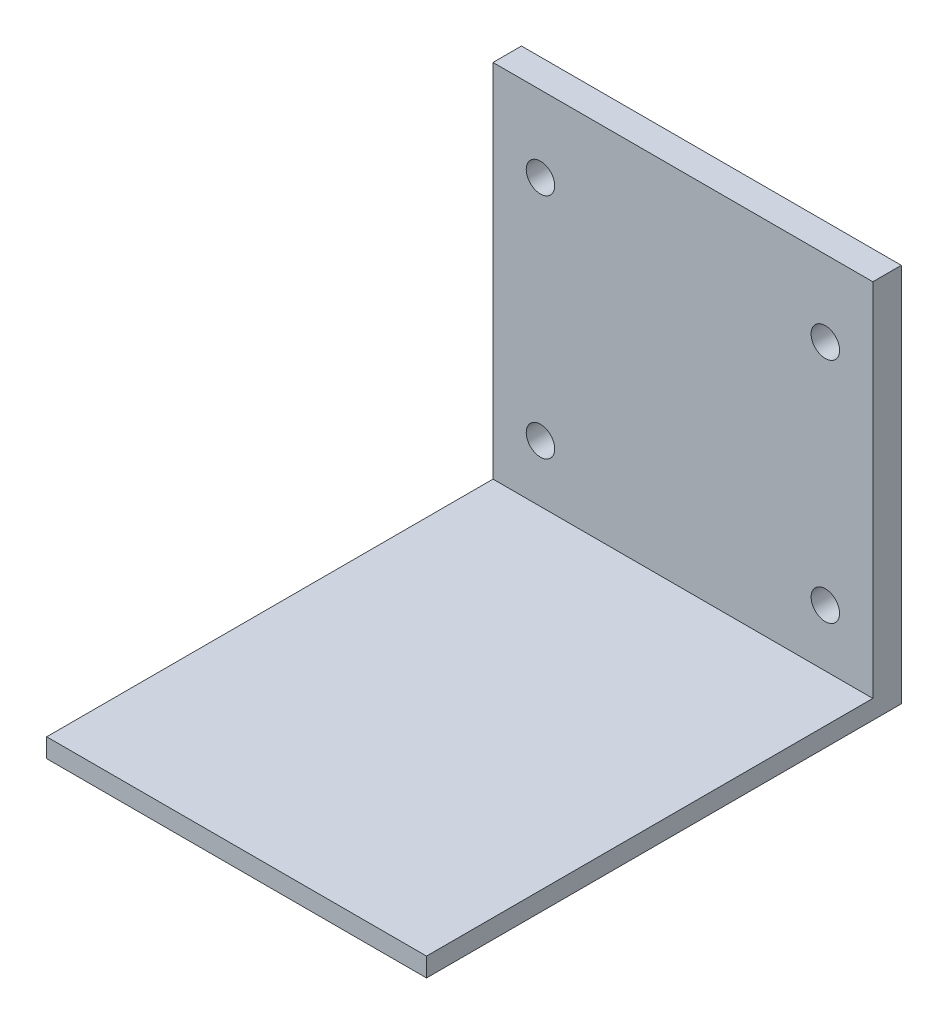
from build123d import *

# Parameters (mm, degrees)
SKETCH_1_W          = 40
SKETCH_1_H          = 40
EXTRUDE_1_DEPTH     = 3
SKETCH_2_R          = 1.5
CUT_EXTRUDE_1_DEPTH = 3
SKETCH_3_W          = 40
SKETCH_3_H          = 2
EXTRUDE_2_DEPTH     = 47


with BuildPart() as part:
    # 草图1 → 凸台-拉伸1 (new body)
    with BuildSketch(Plane.XY):
        with Locations((20, -20)):
            Rectangle(SKETCH_1_W, SKETCH_1_H)
    extrude(amount=EXTRUDE_1_DEPTH)

    # 草图2 → 切除-拉伸1 (cut)
    with BuildSketch(Plane.XY.offset(3)):
        with Locations((35, -8)):
            Circle(SKETCH_2_R)
        with Locations(Location((5, -8, 0), (0, 0, 180))):
            Circle(SKETCH_2_R)
        with Locations((35, -32)):
            Circle(SKETCH_2_R)
        with Locations(Location((5, -32, 0), (0, 0, 180))):
            Circle(SKETCH_2_R)
    extrude(amount=-CUT_EXTRUDE_1_DEPTH, mode=Mode.SUBTRACT)

    # 草图3 → 凸台-拉伸2 (add)
    with BuildSketch(Plane.XY.offset(3)):
        with Locations((20, -39)):
            Rectangle(SKETCH_3_W, SKETCH_3_H)
    extrude(amount=EXTRUDE_2_DEPTH)


solid = part.part
